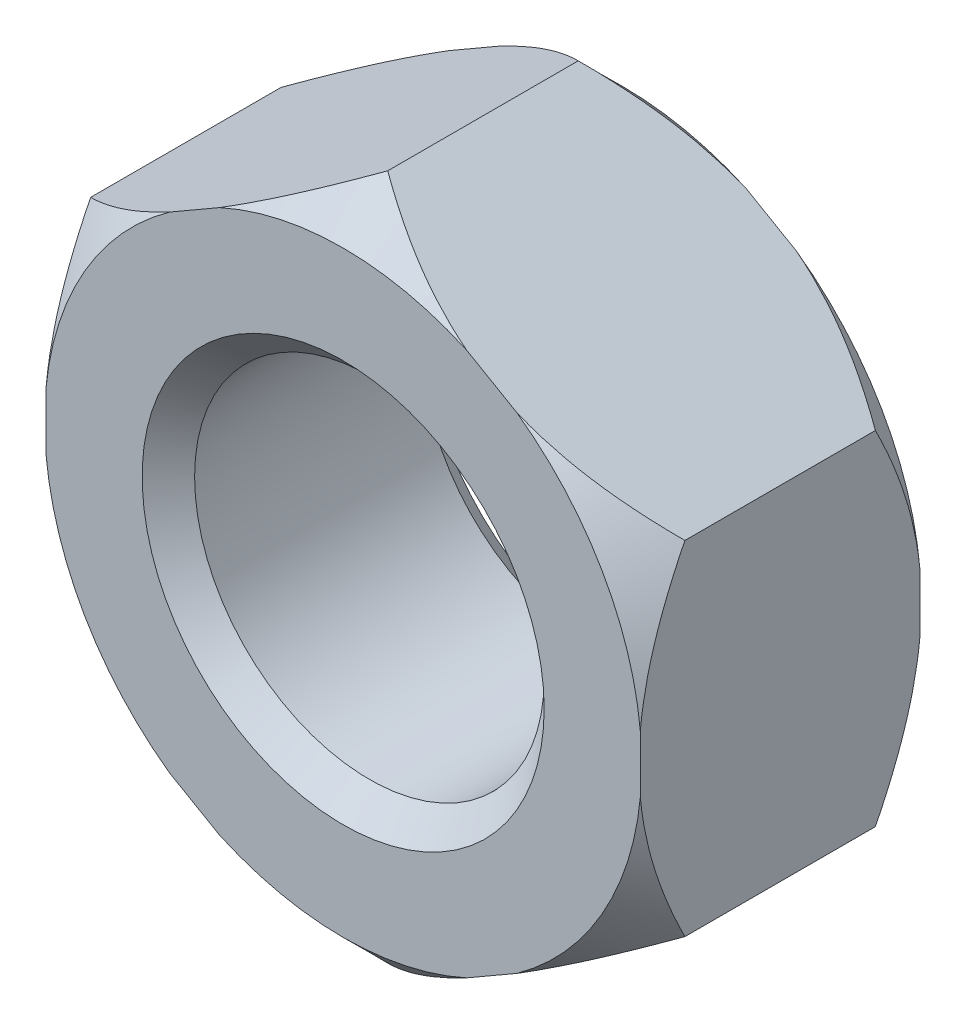
from build123d import *

# Parameters (mm, degrees)
EXTRUDE_1_DEPTH     = 8
SKETCH_2_R          = 5
CUT_EXTRUDE_1_DEPTH = 16.250683045
CHAMFER_1_SIZE      = 0.75


with BuildPart() as part:
    # Эскиз1 → Вытянуть1 (new body)
    with BuildSketch(Plane.XY):
        Polygon((0, 9.814954576), (-8.5, 4.907477288), (-8.5, -4.907477288), (0, -9.814954576), (8.5, -4.907477288), (8.5, 4.907477288), align=None)
    extrude(amount=EXTRUDE_1_DEPTH)

    # Эскиз15 → Вырез-Повернуть1 (revolve, cut)
    with BuildSketch(Plane(origin=(0, 0, 0), x_dir=(0, 0, -1), z_dir=(1, 0, 0))):
        Polygon((-8, 9.814954576), (-8, 8.539954576), (-6.725, 9.814954576), align=None)
        Polygon((-1.275, 9.814954576), (0, 9.814954576), (0, 8.539954576), align=None)
    revolve(axis=Axis((0, 0, 2.633835381), (0, 0, -1)), mode=Mode.SUBTRACT)

    # Эскиз2 → Вырез-Вытянуть1 (cut, through all)
    with BuildSketch(Plane(origin=(0, 0, 0), x_dir=(-1, 0, 0), z_dir=(0, 0, -1))):
        Circle(SKETCH_2_R)
    extrude(amount=-CUT_EXTRUDE_1_DEPTH, mode=Mode.SUBTRACT)

    # Фаска1
    chamfer_1_edges = [part.edges().sort_by_distance(p)[0] for p in [
        (5, 0, 8),
        (5, 0, 0),
    ]]
    chamfer(chamfer_1_edges, length=CHAMFER_1_SIZE)


solid = part.part
